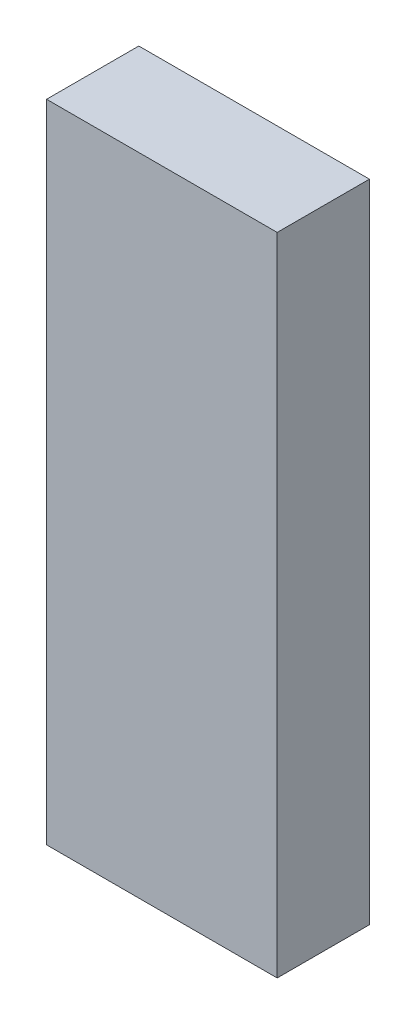
from build123d import *

# Parameters (mm, degrees)
SKETCH1_W           = 50
SKETCH1_H           = 140
BOSS_EXTRUDE1_DEPTH = 20


with BuildPart() as part:
    # Sketch1 → Boss-Extrude1 (new body)
    with BuildSketch(Plane.XY):
        with Locations((3875, 650)):
            Rectangle(SKETCH1_W, SKETCH1_H)
    extrude(amount=BOSS_EXTRUDE1_DEPTH)


solid = part.part
